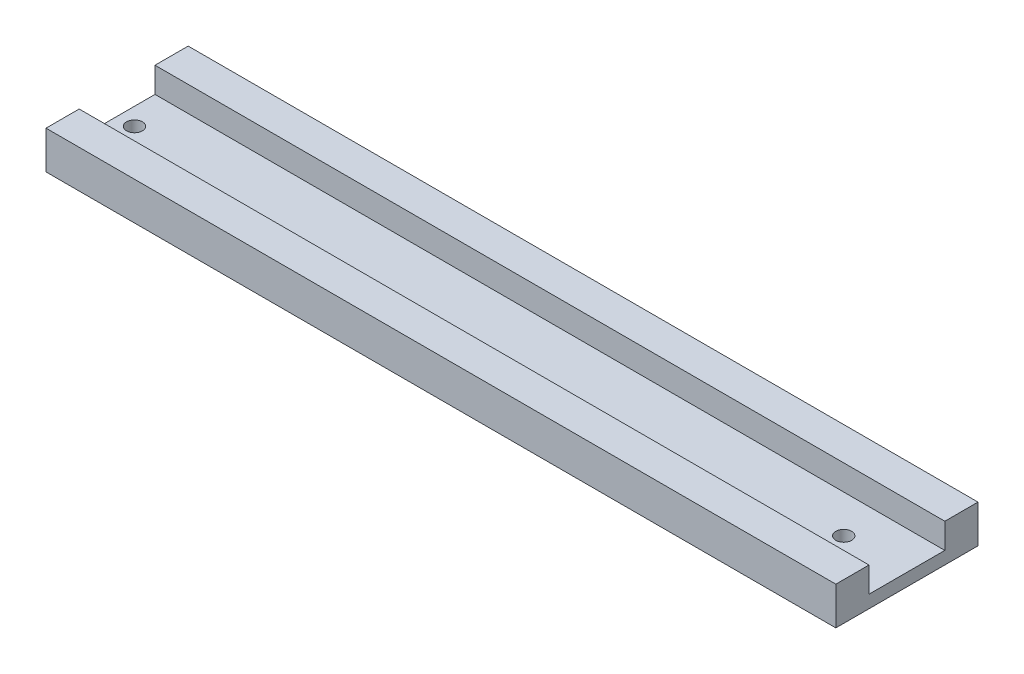
from build123d import *

# Parameters (mm, degrees)
EXTRUDE_1_DEPTH     = 250
SKETCH_4_R          = 2.5
CUT_EXTRUDE_1_DEPTH = 252.082157869


with BuildPart() as part:
    # 草图2 → 凸台-拉伸1 (new body)
    with BuildSketch(Plane(origin=(0, 0, 0), x_dir=(0, 0, -1), z_dir=(1, 0, 0))):
        Polygon((-22.5, 6), (-22.5, -6), (22.5, -6), (22.5, 6), (12, 6), (12, -2), (-12, -2), (-12, 6), align=None)
    extrude(amount=EXTRUDE_1_DEPTH)

    # 草图4 → 切除-拉伸1 (cut, through all)
    with BuildSketch(Plane(origin=(0, 0, 0), x_dir=(1, 0, 0), z_dir=(0, 1, 0))):
        with Locations(Location((230, 0, 0), (0, 0, 270))):
            Circle(SKETCH_4_R)
        with Locations(Location((5.5, 0, 0), (0, 0, 270))):
            Circle(SKETCH_4_R)
    extrude(amount=-CUT_EXTRUDE_1_DEPTH, mode=Mode.SUBTRACT)


solid = part.part
